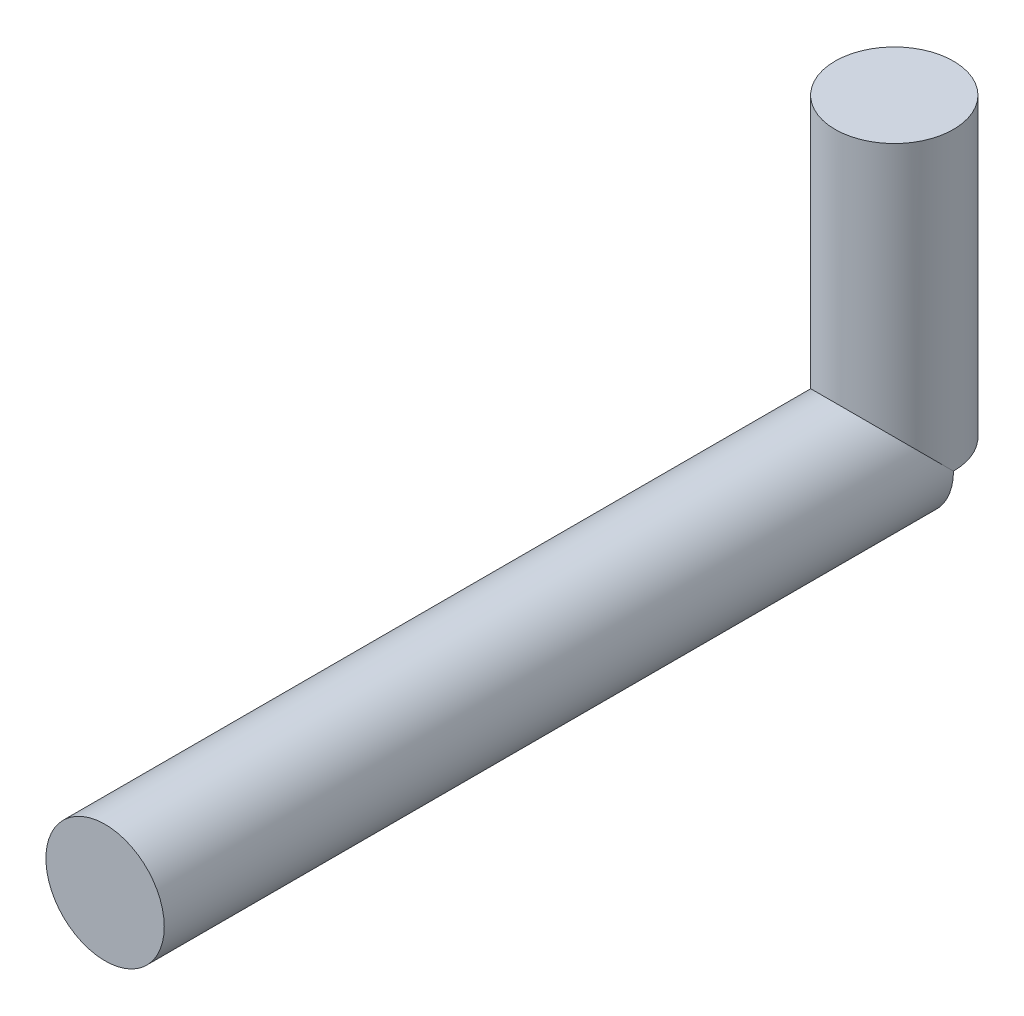
from build123d import *

# Parameters (mm, degrees)
SKETCH_1_R      = 0.3
EXTRUDE_1_DEPTH = 4
SKETCH_2_R      = 0.3
EXTRUDE_2_DEPTH = 1.5


with BuildPart() as part:
    # 草图1 → 凸台-拉伸1 (new body)
    with BuildSketch(Plane.XY):
        Circle(SKETCH_1_R)
    extrude(amount=EXTRUDE_1_DEPTH)

    # 草图2 → 凸台-拉伸2 (add)
    with BuildSketch(Plane(origin=(0, 0, 0), x_dir=(1, 0, 0), z_dir=(0, 1, 0))):
        with Locations(Location((0, 0, 0), (0, 0, 180))):
            Circle(SKETCH_2_R)
    extrude(amount=EXTRUDE_2_DEPTH)


solid = part.part
